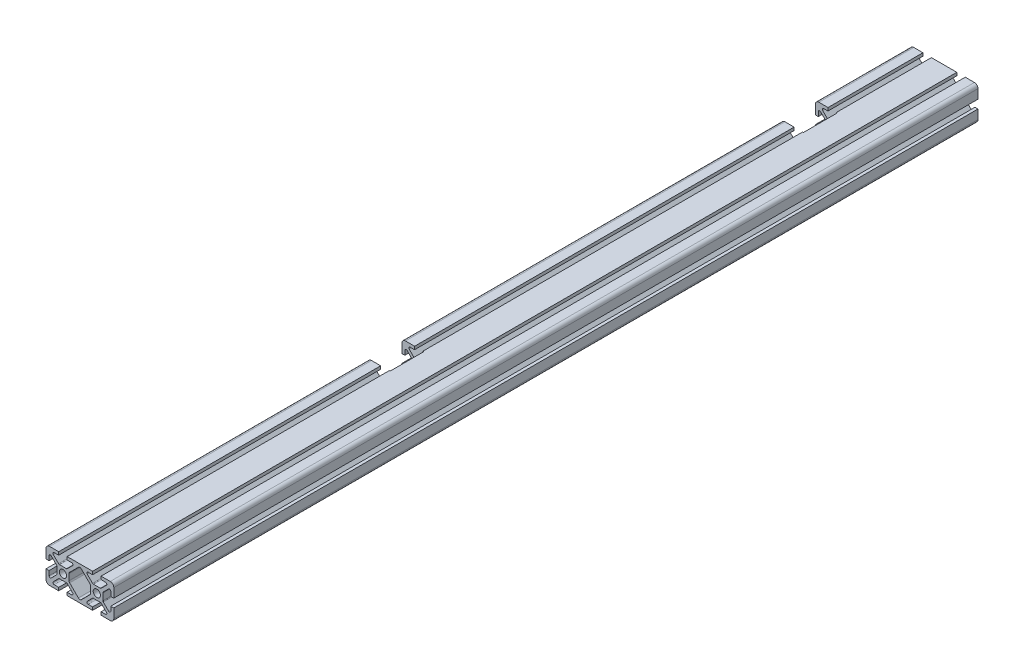
from build123d import *

# Parameters (mm, degrees)
BOSS_EXTRUDE1_DEPTH = 1524
BOSS_EXTRUDE2_DEPTH = 1524
FILLET1_R           = 0.75
FILLET2_R           = 1.25
SKETCH5_W           = 2538
SKETCH5_H           = 20
CUT_EXTRUDE1_DEPTH  = 1525.55764076
SKETCH6_W           = 13
SKETCH6_H           = 20
CUT_EXTRUDE2_DEPTH  = 40


with BuildPart() as part:
    # Sketch3 → Boss-Extrude1 (new, symmetric)
    with BuildSketch(Plane.XY):
        with BuildLine():
            Line((12.5, -10), (17.9, -10))
            ThreePointArc((17.9, -10), (19.38492424, -9.38492424), (20, -7.9))
            Line((20, -7.9), (20, -2.5))
            Line((20, -2.5), (18.213351365, -2.5))
            Line((18.213351365, -2.5), (18.213351365, -6.95))
            Line((18.213351365, -6.95), (13.6, -2.336648635))
            Line((13.6, -2.336648635), (13.6, 0))
            Line((13.6, 0), (12.15, 0))
            ThreePointArc((12.15, 0), (11.52027958, -1.52027958), (10, -2.15))
            Line((10, -2.15), (10, -3.6))
            Line((10, -3.6), (12.336648635, -3.6))
            Line((12.336648635, -3.6), (16.95, -8.213351365))
            Line((16.95, -8.213351365), (12.5, -8.213351365))
            Line((12.5, -8.213351365), (12.5, -10))
        make_face()
    extrude(amount=BOSS_EXTRUDE1_DEPTH, both=True)

    # Sketch4 → Boss-Extrude2 (add, symmetric)
    with BuildSketch(Plane.XY):
        with BuildLine():
            Line((10, -3.6), (7.663351365, -3.6))
            Line((7.663351365, -3.6), (3.05, -8.213351365))
            Line((3.05, -8.213351365), (7.5, -8.213351365))
            Line((7.5, -8.213351365), (7.5, -10))
            Line((7.5, -10), (0, -10))
            Line((0, -10), (0, -8.736648635))
            Line((0, -8.736648635), (6.4, -2.336648635))
            Line((6.4, -2.336648635), (6.4, 0))
            Line((6.4, 0), (7.85, 0))
            ThreePointArc((7.85, 0), (8.47972042, -1.52027958), (10, -2.15))
            Line((10, -2.15), (10, -3.6))
        make_face()
    extrude(amount=BOSS_EXTRUDE2_DEPTH, both=True)

    # Mirror1: part across plane


with BuildPart() as part_1:
    add(part.part)
    add(part.part.mirror(Plane(origin=(0, 0, 0), x_dir=(0, 0, 1), z_dir=(1, 0, 0))))

    # Mirror2: part across plane


with BuildPart() as part_2:
    add(part_1.part)
    add(part_1.part.mirror(Plane.ZX))

    # Fillet1
    fillet1_edges = [part_2.edges().sort_by_distance(p)[0] for p in [
        (18.213351365, 6.95, 0),
        (13.6, 2.336648635, 0),
        (12.336648635, 3.6, 0),
        (16.95, 8.213351365, 0),
        (3.05, 8.213351365, 0),
        (7.663351365, 3.6, 0),
        (-18.213351365, 6.95, 0),
        (-13.6, 2.336648635, 0),
        (-7.663351365, 3.6, 0),
        (-12.336648635, 3.6, 0),
        (-16.95, 8.213351365, 0),
        (-3.05, 8.213351365, 0),
        (16.95, -8.213351365, 0),
        (12.336648635, -3.6, 0),
        (13.6, -2.336648635, 0),
        (18.213351365, -6.95, 0),
        (3.05, -8.213351365, 0),
        (7.663351365, -3.6, 0),
        (-18.213351365, -6.95, 0),
        (-13.6, -2.336648635, 0),
        (-12.336648635, -3.6, 0),
        (-16.95, -8.213351365, 0),
        (-3.05, -8.213351365, 0),
        (-7.663351365, -3.6, 0),
    ]]
    fillet(fillet1_edges, radius=FILLET1_R)

    # Fillet2
    fillet2_edges = [part_2.edges().sort_by_distance(p)[0] for p in [
        (6.4, 2.336648635, 0),
        (0, 8.736648635, 0),
        (-6.4, 2.336648635, 0),
        (6.4, -2.336648635, 0),
        (-6.4, -2.336648635, 0),
        (0, -8.736648635, 0),
    ]]
    fillet(fillet2_edges, radius=FILLET2_R)

    # Sketch5 → Cut-Extrude1 (cut, through all)
    with BuildSketch(Plane.ZY.offset(20)):
        with Locations((255, 0)):
            Rectangle(SKETCH5_W, SKETCH5_H)
    extrude(amount=-CUT_EXTRUDE1_DEPTH, mode=Mode.SUBTRACT)

    # Sketch6 → Cut-Extrude2 (cut)
    with BuildSketch(Plane(origin=(0, 10, 0), x_dir=(1, 0, 0), z_dir=(0, 1, 0))):
        with Locations((-13.5, 1214)):
            Rectangle(SKETCH6_W, SKETCH6_H)
        with Locations((-13.5, 1458)):
            Rectangle(SKETCH6_W, SKETCH6_H)
    extrude(amount=-CUT_EXTRUDE2_DEPTH, mode=Mode.SUBTRACT)


solid = part_2.part
